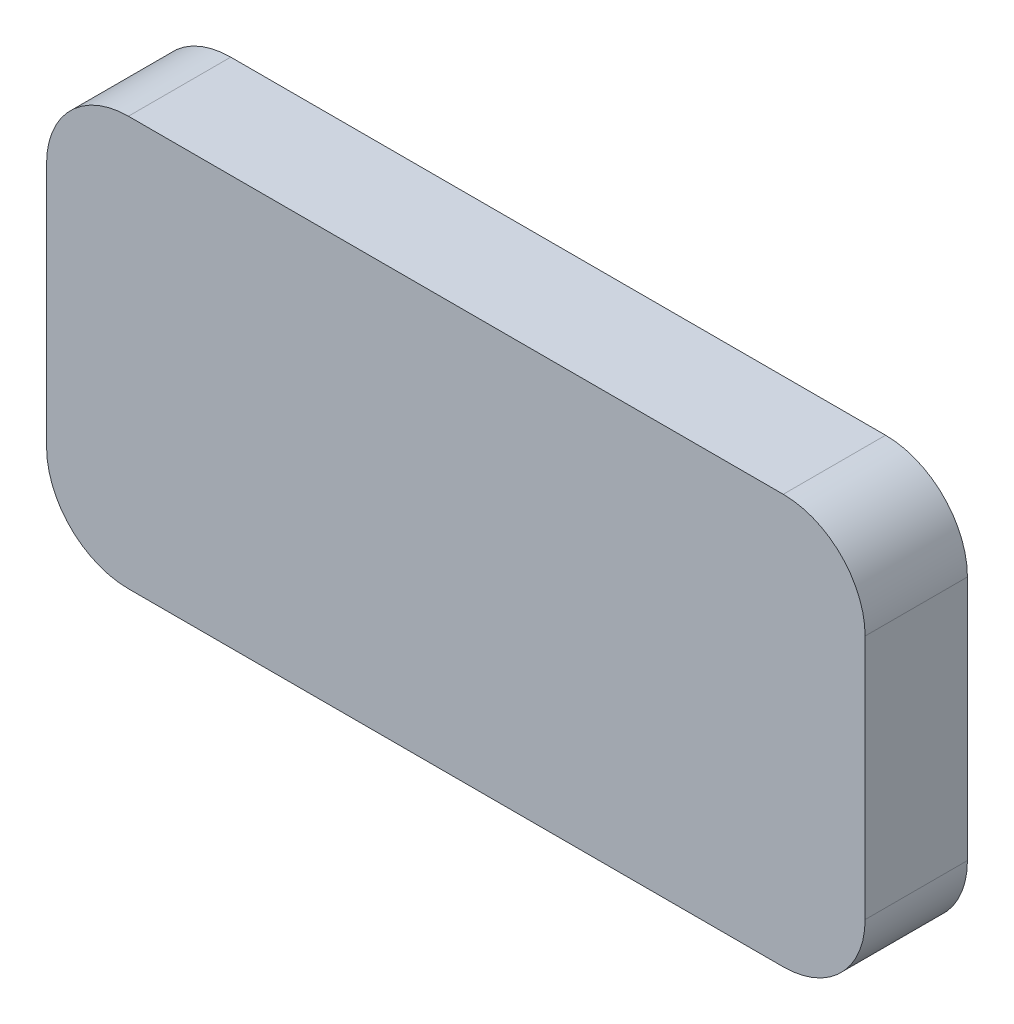
from build123d import *

# Parameters (mm, degrees)
EXTRUDE_1_DEPTH = 5


with BuildPart() as part:
    # Эскиз1 → Бобышка-Вытянуть1 (new body)
    with BuildSketch(Plane.XY):
        with BuildLine():
            Line((-16, -10), (16, -10))
            ThreePointArc((16, -10), (18.828427125, -8.828427125), (20, -6))
            Line((20, -6), (20, 6))
            ThreePointArc((20, 6), (18.828427125, 8.828427125), (16, 10))
            Line((16, 10), (-16, 10))
            ThreePointArc((-16, 10), (-18.828427125, 8.828427125), (-20, 6))
            Line((-20, 6), (-20, -6))
            ThreePointArc((-20, -6), (-18.828427125, -8.828427125), (-16, -10))
        make_face()
    extrude(amount=EXTRUDE_1_DEPTH)


solid = part.part
